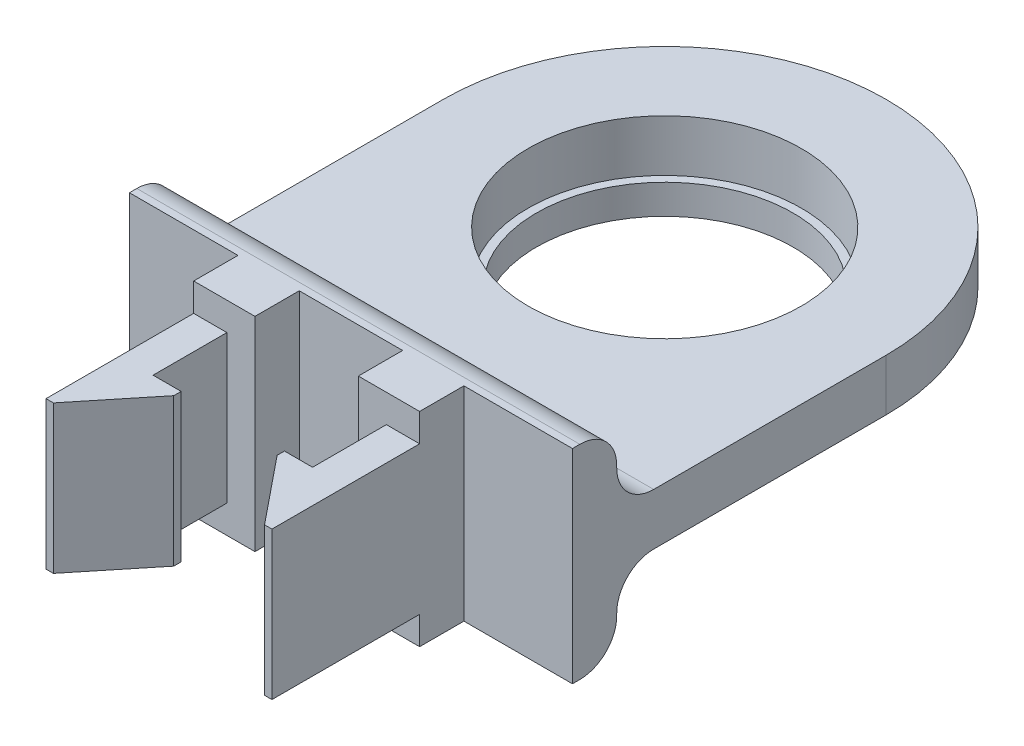
from build123d import *

# Parameters (mm, degrees)
SKETCH1_R           = 18.5
BOSS_EXTRUDE1_DEPTH = 7
BOSS_EXTRUDE3_DEPTH = 10
BOSS_EXTRUDE4_DEPTH = 13.8
BOSS_EXTRUDE5_START = -13.8
SKETCH4_W           = 60
SKETCH4_H           = 6
BOSS_EXTRUDE5_DEPTH = 27.6
FILLET2_R           = 5
SKETCH5_R           = 20
SKETCH5_R_2         = 17.375
BOSS_EXTRUDE6_DEPTH = 4


with BuildPart() as part:
    # Sketch1 → Boss-Extrude1 (new body)
    with BuildSketch(Plane(origin=(0, 0, 0), x_dir=(1, 0, 0), z_dir=(0, 1, 0))):
        with BuildLine():
            Line((-30, 0), (-30, 42.5))
            ThreePointArc((-30, 42.5), (0, 72.5), (30, 42.5))
            Line((30, 42.5), (30, 0))
            Line((30, 0), (-30, 0))
        make_face()
        with Locations(Location((0, 42.5, 0), (0, 0, 270))):
            Circle(SKETCH1_R, mode=Mode.SUBTRACT)
    extrude(amount=BOSS_EXTRUDE1_DEPTH)

    # Sketch3<3> → Boss-Extrude4 (add, symmetric)
    with BuildSketch(Plane(origin=(-4, 3.5, 0), x_dir=(0, 0, 1), z_dir=(0, -1, 0))):
        Polygon((0, 11.3), (0, 3), (6, 3), (6, 6.8), (6, 11.3), align=None)
    boss_extrude4 = extrude(amount=BOSS_EXTRUDE4_DEPTH, both=True)

    # Mirror8: Boss-Extrude4 across plane
    add(boss_extrude4.mirror(Plane.ZY))


with BuildPart() as body_2:
    # Sketch3 → Boss-Extrude3 (new, symmetric)
    with BuildSketch(Plane(origin=(-4, 3.5, 0), x_dir=(0, 0, 1), z_dir=(0, -1, 0))):
        Polygon((26, 10.3), (17, 3), (16, 3), (16, 6.8), (6, 6.8), (6, 11.3), (26, 11.3), align=None)
    boss_extrude3 = extrude(amount=BOSS_EXTRUDE3_DEPTH, both=True)


with BuildPart() as part_1:
    add(part.part)

    # Mirror9: Boss-Extrude3 across plane
    add(boss_extrude3.mirror(Plane.ZY))

    # Sketch4 → Boss-Extrude5 (add)
    with BuildSketch(Plane(origin=(0, 3.5, 0), x_dir=(-1, 0, 0), z_dir=(0, -1, 0)).offset(BOSS_EXTRUDE5_START)):
        with Locations((0, 3)):
            Rectangle(SKETCH4_W, SKETCH4_H)
    extrude(amount=BOSS_EXTRUDE5_DEPTH)

    # Fillet2
    fillet2_edges = [part_1.edges().sort_by_distance(p)[0] for p in [
        (0, 17.3, -6),
        (0, 7, -6),
        (0, 0, -6),
        (0, -10.3, -6),
    ]]
    fillet(fillet2_edges, radius=FILLET2_R)

    # Sketch5 → Boss-Extrude6 (add)
    with BuildSketch(Plane(origin=(0, 0, 0), x_dir=(1, 0, 0), z_dir=(0, 1, 0))):
        with Locations(Location((0, 42.5, 0), (0, 0, 270))):
            Circle(SKETCH5_R)
        with Locations(Location((0, 42.5, 0), (0, 0, 270))):
            Circle(SKETCH5_R_2, mode=Mode.SUBTRACT)
    extrude(amount=-BOSS_EXTRUDE6_DEPTH)


solid = Compound([body_2.part, part_1.part])
